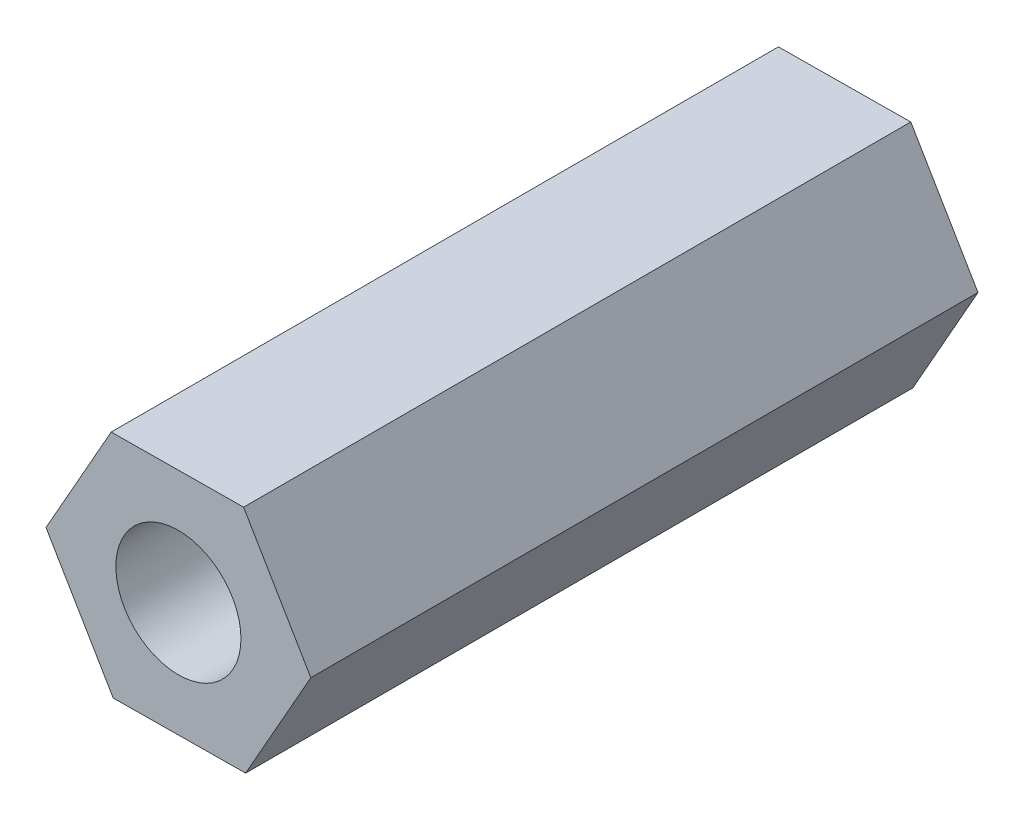
from build123d import *

# Parameters (mm, degrees)
SKETCH_1_R      = 1.5
EXTRUDE_1_DEPTH = 16


with BuildPart() as part:
    # 草图1 → 凸台-拉伸1 (new body)
    with BuildSketch(Plane.XY):
        Polygon((1.61185848, -2.735917684), (3.175303457, 0.027951549), (1.563444977, 2.763869233), (-1.61185848, 2.735917684), (-3.175303457, -0.027951549), (-1.563444977, -2.763869233), align=None)
        Circle(SKETCH_1_R, mode=Mode.SUBTRACT)
    extrude(amount=EXTRUDE_1_DEPTH)


solid = part.part
